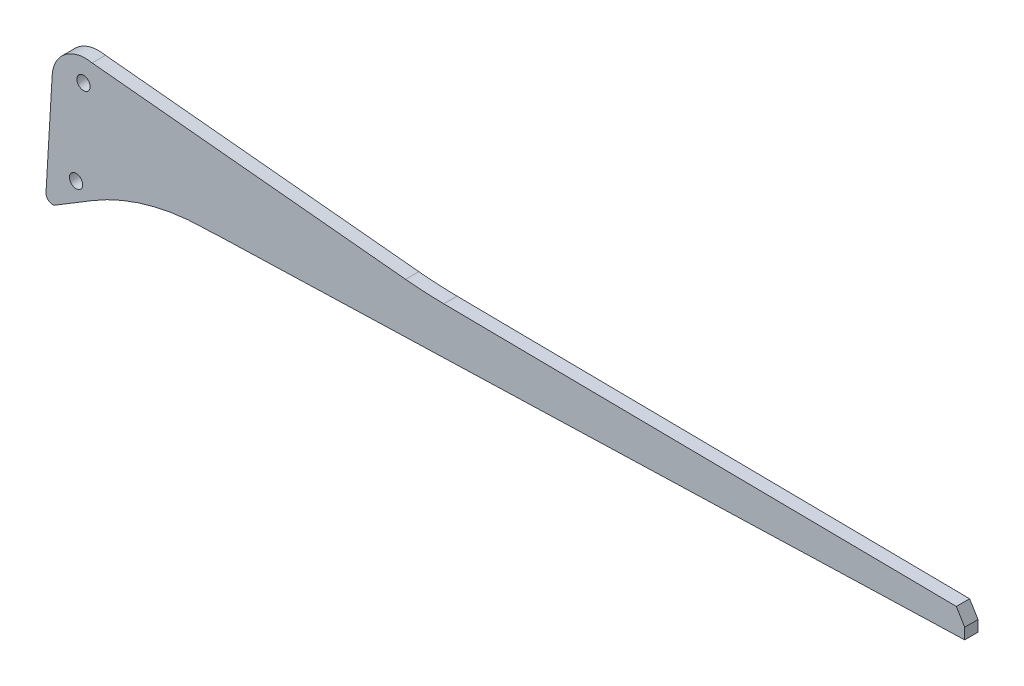
from build123d import *

# Parameters (mm, degrees)
SKETCH1_R           = 3
BOSS_EXTRUDE3_DEPTH = 6
SCALE1_SCALE        = 0.5


with BuildPart() as part:
    # Sketch1 → Boss-Extrude3 (new body)
    with BuildSketch(Plane.XY):
        with BuildLine():
            Line((236.346486318, 61.328001261), (233.557157529, 14.05846688))
            ThreePointArc((233.557157529, 14.05846688), (234.631574503, 11.576933684), (237.266269116, 10.968030468))
            Line((237.266269116, 10.968030468), (254.377513225, 21.340067299))
            ThreePointArc((254.377513225, 21.340067299), (278.773329443, 31.985318101), (305.113217886, 35.817744276))
            ThreePointArc((305.113217886, 35.817744276), (308.442395565, 35.909839099), (311.76666015, 36.112744111))
            Line((311.76666015, 36.112744111), (648.006438707, 46.528011178))
            Line((648.006438707, 46.528011178), (648.006438707, 51.498330229))
            Line((648.006438707, 51.498330229), (644.232143491, 57.724965154))
            Line((644.232143491, 57.724965154), (413.007588136, 60.346556463))
            ThreePointArc((413.007588136, 60.346556463), (404.387645707, 60.630259841), (395.787949399, 61.285331218))
            Line((395.787949399, 61.285331218), (254.377513225, 75.129575697))
            ThreePointArc((254.377513225, 75.129575697), (242.203210075, 72.35558012), (236.346486318, 61.328001261))
        make_face()
        with Locations((250.480867538, 65.373411048)):
            Circle(SKETCH1_R, mode=Mode.SUBTRACT)
        with Locations((247.123521652, 25.373411048)):
            Circle(SKETCH1_R, mode=Mode.SUBTRACT)
    extrude(amount=-BOSS_EXTRUDE3_DEPTH)


with BuildPart() as part_1:
    # Scale1: scaled about (389.049818366, 50.358874463, -3)
    add(part.part.scale(SCALE1_SCALE).moved(Location((194.524909183, 25.179437231, -1.5))))


solid = part_1.part
